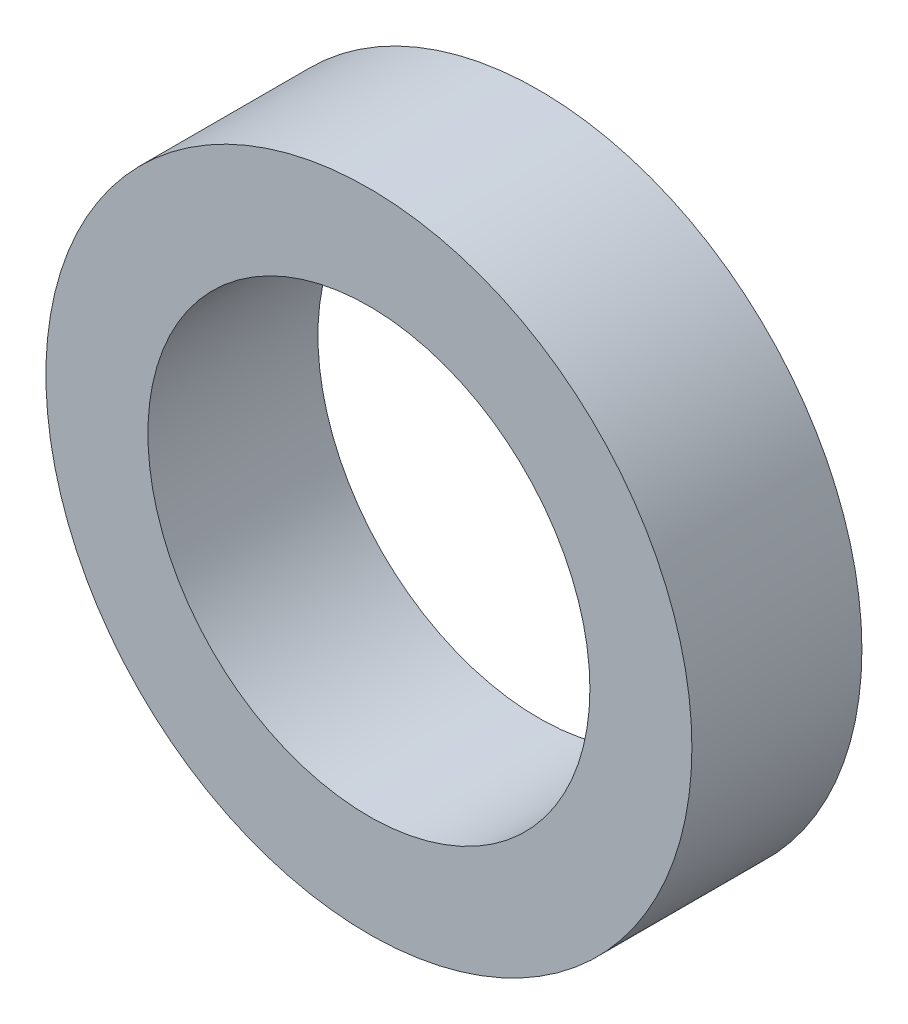
from build123d import *

# Parameters (mm, degrees)
SKETCH1_R           = 9.5
SKETCH1_R_2         = 6.5
BOSS_EXTRUDE1_DEPTH = 2.5


with BuildPart() as part:
    # Sketch1 → Boss-Extrude1 (new, symmetric)
    with BuildSketch(Plane.XY):
        Circle(SKETCH1_R)
        Circle(SKETCH1_R_2, mode=Mode.SUBTRACT)
    extrude(amount=BOSS_EXTRUDE1_DEPTH, both=True)


solid = part.part
